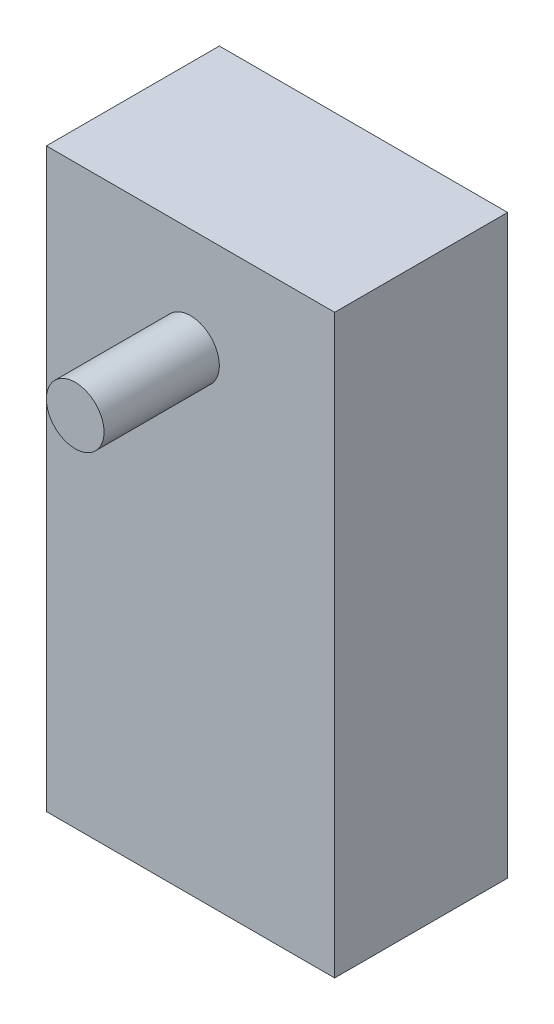
from build123d import *

# Parameters (mm, degrees)
SKETCH1_W           = 31.75
SKETCH1_H           = 63.5
BOSS_EXTRUDE1_DEPTH = 19.05
SKETCH2_R           = 3.175
BOSS_EXTRUDE2_DEPTH = 12.7


with BuildPart() as part:
    # Sketch1 → Boss-Extrude1 (new body)
    with BuildSketch(Plane.XY):
        Rectangle(SKETCH1_W, SKETCH1_H)
    extrude(amount=BOSS_EXTRUDE1_DEPTH)

    # Sketch2 → Boss-Extrude2 (add)
    with BuildSketch(Plane.XY.offset(19.05)):
        with Locations((0, 20.315619897)):
            Circle(SKETCH2_R)
    extrude(amount=BOSS_EXTRUDE2_DEPTH)


solid = part.part
